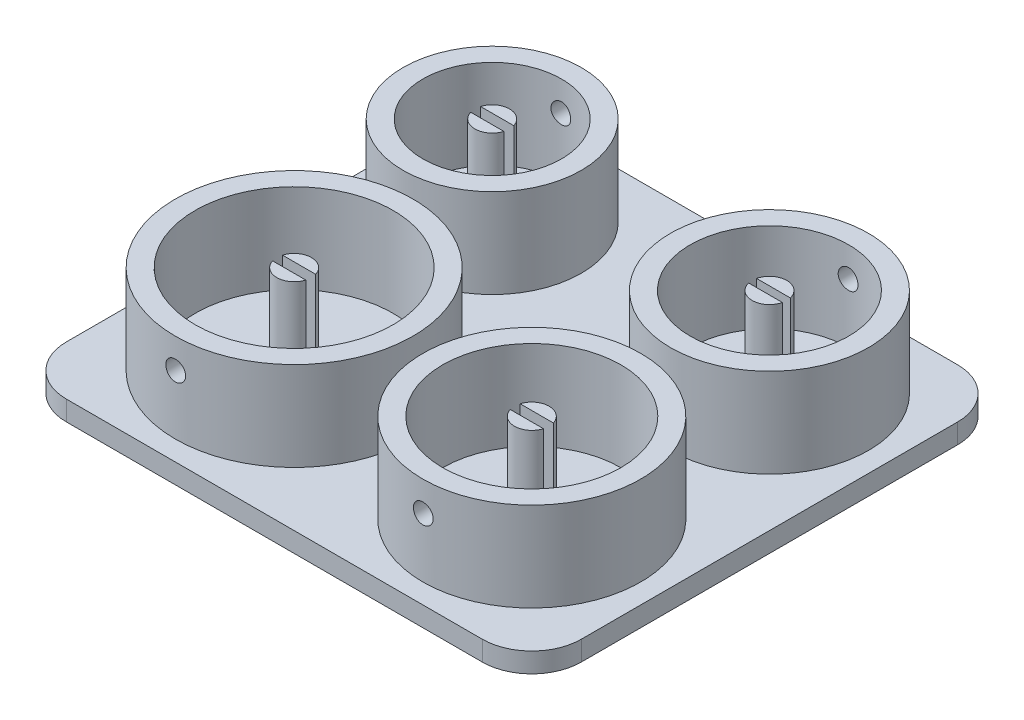
from build123d import *

# Parameters (mm, degrees)
SKETCH1_W           = 52
SKETCH1_H           = 48
BOSS_EXTRUDE3_DEPTH = 2
SKETCH4_R           = 9
SKETCH4_R_2         = 7
SKETCH4_R_3         = 10
SKETCH4_R_4         = 8
SKETCH4_R_5         = 11
SKETCH4_R_6         = 12
BOSS_EXTRUDE4_DEPTH = 9
BOSS_EXTRUDE5_DEPTH = 9
SKETCH6_R           = 1
CUT_EXTRUDE2_DEPTH  = 6
SKETCH7_R           = 1
CUT_EXTRUDE3_DEPTH  = 6
FILLET1_R           = 5


with BuildPart() as part:
    # Sketch1 → Boss-Extrude3 (new body)
    with BuildSketch(Plane(origin=(0, 0, 0), x_dir=(1, 0, 0), z_dir=(0, 1, 0))):
        with Locations((-110.938964427, -50.099195195)):
            Rectangle(SKETCH1_W, SKETCH1_H)
    extrude(amount=BOSS_EXTRUDE3_DEPTH)

    # Sketch4 → Boss-Extrude4 (add)
    # profile 1 of 4: a face of its own
    with BuildSketch(Plane(origin=(0, 2, 0), x_dir=(1, 0, 0), z_dir=(0, 1, 0))):
        with Locations(Location((-125.938964427, -37.099195195, 0), (0, 0, 270))):
            Circle(SKETCH4_R)
        with Locations(Location((-125.938964427, -37.099195195, 0), (0, 0, 270))):
            Circle(SKETCH4_R_2, mode=Mode.SUBTRACT)
    # profile 2 of 4: a face of its own
    with BuildSketch(Plane(origin=(0, 2, 0), x_dir=(1, 0, 0), z_dir=(0, 1, 0))):
        with Locations(Location((-96.938964427, -38.099195195, 0), (0, 0, 270))):
            Circle(SKETCH4_R_3)
        with Locations(Location((-96.938964427, -38.099195195, 0), (0, 0, 270))):
            Circle(SKETCH4_R_4, mode=Mode.SUBTRACT)
    # profile 3 of 4: a face of its own
    with BuildSketch(Plane(origin=(0, 2, 0), x_dir=(1, 0, 0), z_dir=(0, 1, 0))):
        with Locations(Location((-97.938964427, -61.099195195, 0), (0, 0, 270))):
            Circle(SKETCH4_R_5)
        with Locations(Location((-97.938964427, -61.099195195, 0), (0, 0, 270))):
            Circle(SKETCH4_R, mode=Mode.SUBTRACT)
    # profile 4 of 4: a face of its own
    with BuildSketch(Plane(origin=(0, 2, 0), x_dir=(1, 0, 0), z_dir=(0, 1, 0))):
        with Locations(Location((-122.938964427, -60.099195195, 0), (0, 0, 270))):
            Circle(SKETCH4_R_6)
        with Locations(Location((-122.938964427, -60.099195195, 0), (0, 0, 270))):
            Circle(SKETCH4_R_3, mode=Mode.SUBTRACT)
    extrude(amount=BOSS_EXTRUDE4_DEPTH)

    # Sketch5 → Boss-Extrude5 (add)
    with BuildSketch(Plane(origin=(0, 2, 0), x_dir=(1, 0, 0), z_dir=(0, 1, 0))):
        with BuildLine():
            Line((-124.61601541, -59.599195195), (-122.938964427, -59.599195195))
            Line((-122.938964427, -59.599195195), (-121.261913444, -59.599195195))
            ThreePointArc((-121.261913444, -59.599195195), (-122.938964427, -58.349195195), (-124.61601541, -59.599195195))
        make_face()
        with BuildLine():
            Line((-121.261913444, -60.599195195), (-124.61601541, -60.599195195))
            ThreePointArc((-124.61601541, -60.599195195), (-122.938964427, -61.849195195), (-121.261913444, -60.599195195))
        make_face()
        with BuildLine():
            Line((-99.61601541, -60.599195195), (-97.938964427, -60.599195195))
            Line((-97.938964427, -60.599195195), (-96.261913444, -60.599195195))
            ThreePointArc((-96.261913444, -60.599195195), (-97.938964427, -59.349195195), (-99.61601541, -60.599195195))
        make_face()
        with BuildLine():
            Line((-96.261913444, -61.599195195), (-99.61601541, -61.599195195))
            ThreePointArc((-99.61601541, -61.599195195), (-97.938964427, -62.849195195), (-96.261913444, -61.599195195))
        make_face()
        with BuildLine():
            Line((-98.642636931, -37.699195195), (-96.938964427, -37.699195195))
            Line((-96.938964427, -37.699195195), (-95.235291923, -37.699195195))
            ThreePointArc((-95.235291923, -37.699195195), (-96.938964427, -36.349195195), (-98.642636931, -37.699195195))
        make_face()
        with BuildLine():
            Line((-95.235291923, -38.499195195), (-98.642636931, -38.499195195))
            ThreePointArc((-98.642636931, -38.499195195), (-96.938964427, -39.849195195), (-95.235291923, -38.499195195))
        make_face()
        with BuildLine():
            Line((-127.61601541, -36.599195195), (-125.938964427, -36.599195195))
            Line((-125.938964427, -36.599195195), (-124.261913444, -36.599195195))
            ThreePointArc((-124.261913444, -36.599195195), (-125.938964427, -35.349195195), (-127.61601541, -36.599195195))
        make_face()
        with BuildLine():
            Line((-124.261913444, -37.599195195), (-127.61601541, -37.599195195))
            ThreePointArc((-127.61601541, -37.599195195), (-125.938964427, -38.849195195), (-124.261913444, -37.599195195))
        make_face()
    extrude(amount=BOSS_EXTRUDE5_DEPTH)

    # Sketch6 → Cut-Extrude2 (cut)
    with BuildSketch(Plane.XY.offset(74.099195195)):
        with Locations((-97.938964427, 8)):
            Circle(SKETCH6_R)
        with Locations((-122.938964427, 8)):
            Circle(SKETCH6_R)
    extrude(amount=-CUT_EXTRUDE2_DEPTH, mode=Mode.SUBTRACT)

    # Sketch7 → Cut-Extrude3 (cut)
    with BuildSketch(Plane(origin=(0, 0, 26.099195195), x_dir=(-1, 0, 0), z_dir=(0, 0, -1))):
        with Locations(Location((96.938964427, 8, 0), (0, 0, 90))):
            Circle(SKETCH7_R)
        with Locations(Location((125.938964427, 8, 0), (0, 0, 90))):
            Circle(SKETCH7_R)
    extrude(amount=-CUT_EXTRUDE3_DEPTH, mode=Mode.SUBTRACT)

    # Fillet1
    fillet1_edges = [part.edges().sort_by_distance(p)[0] for p in [
        (-136.938964427, 1, 26.099195195),
        (-84.938964427, 1, 26.099195195),
        (-84.938964427, 1, 74.099195195),
        (-136.938964427, 1, 74.099195195),
    ]]
    fillet(fillet1_edges, radius=FILLET1_R)


solid = part.part
